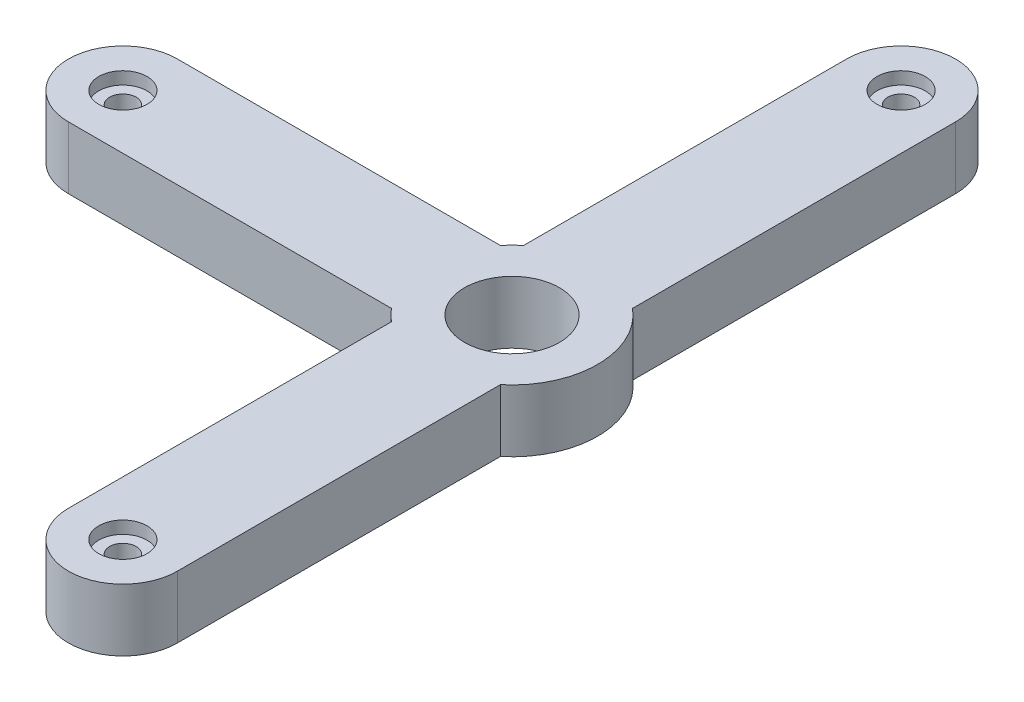
from build123d import *

# Parameters (mm, degrees)
BASE_OUTLINE_SKETCH_R          = 1.7
BASE_OUTLINE_SKETCH_R_2        = 1.75
BASE_OUTLINE_SKETCH_R_3        = 6.1
BASE_OUTLINE_DEPTH             = 4
INTERFACE_PROFILE_2_SKETCH_R   = 1.7
INTERFACE_PROFILE_2_SKETCH_R_2 = 6.1
INTERFACE_PROFILE_2_SKETCH_R_3 = 1.1
INTERFACE_PROFILE_2_DEPTH      = 2.4
INTERFACE_PROFILE_3_SKETCH_R   = 6.1
INTERFACE_PROFILE_3_SKETCH_R_2 = 3.1
INTERFACE_PROFILE_3_SKETCH_R_3 = 1.1
INTERFACE_PROFILE_3_DEPTH      = 0.6
INTERFACE_PROFILE_4_SKETCH_R   = 6.1
INTERFACE_PROFILE_4_SKETCH_R_2 = 3.1
INTERFACE_PROFILE_4_DEPTH      = 1


with BuildPart() as part:
    # Base Outline Sketch → Base Outline (new body)
    with BuildSketch(Plane(origin=(0, -157, 0), x_dir=(1, 0, 0), z_dir=(0, 1, 0))):
        with BuildLine():
            Line((-106.291651246, -7), (-64.77693262, -7))
            ThreePointArc((-64.77693262, -7), (-64.069825839, -7.778174593), (-63.291651246, -8.485281374))
            Line((-63.291651246, -8.485281374), (-63.291651246, -50))
            ThreePointArc((-63.291651246, -50), (-56.291651246, -57), (-49.291651246, -50))
            Line((-49.291651246, -50), (-49.291651246, -8.485281374))
            ThreePointArc((-49.291651246, -8.485281374), (-45.291651246, 0), (-49.291651246, 8.485281374))
            Line((-49.291651246, 8.485281374), (-49.291651246, 50))
            ThreePointArc((-49.291651246, 50), (-56.291651246, 57), (-63.291651246, 50))
            Line((-63.291651246, 50), (-63.291651246, 8.485281374))
            ThreePointArc((-63.291651246, 8.485281374), (-64.069825839, 7.778174593), (-64.77693262, 7))
            Line((-64.77693262, 7), (-106.291651246, 7))
            ThreePointArc((-106.291651246, 7), (-113.291651246, 0), (-106.291651246, -7))
        make_face()
        with Locations(Location((-106.291651246, 0, 0), (0, 0, 270))):
            Circle(BASE_OUTLINE_SKETCH_R, mode=Mode.SUBTRACT)
        with Locations(Location((-56.291651246, 50, 0), (0, 0, 270))):
            Circle(BASE_OUTLINE_SKETCH_R, mode=Mode.SUBTRACT)
        with Locations(Location((-56.291651246, 9, 0), (0, 0, 270))):
            Circle(BASE_OUTLINE_SKETCH_R_2, mode=Mode.SUBTRACT)
        with Locations(Location((-65.291651246, 0, 0), (0, 0, 270))):
            Circle(BASE_OUTLINE_SKETCH_R_2, mode=Mode.SUBTRACT)
        with Locations(Location((-56.291651246, 0, 0), (0, 0, 270))):
            Circle(BASE_OUTLINE_SKETCH_R_3, mode=Mode.SUBTRACT)
        with Locations(Location((-56.291651246, -9, 0), (0, 0, 270))):
            Circle(BASE_OUTLINE_SKETCH_R_2, mode=Mode.SUBTRACT)
        with Locations(Location((-56.291651246, -50, 0), (0, 0, 270))):
            Circle(BASE_OUTLINE_SKETCH_R, mode=Mode.SUBTRACT)
    extrude(amount=BASE_OUTLINE_DEPTH)

    # Interface Profile 2 Sketch → Interface Profile 2 (add)
    with BuildSketch(Plane(origin=(0, -153, 0), x_dir=(1, 0, 0), z_dir=(0, 1, 0))):
        with BuildLine():
            Line((-106.291651246, -7), (-64.77693262, -7))
            ThreePointArc((-64.77693262, -7), (-64.069825839, -7.778174593), (-63.291651246, -8.485281374))
            Line((-63.291651246, -8.485281374), (-63.291651246, -50))
            ThreePointArc((-63.291651246, -50), (-56.291651246, -57), (-49.291651246, -50))
            Line((-49.291651246, -50), (-49.291651246, -8.485281374))
            ThreePointArc((-49.291651246, -8.485281374), (-45.291651246, 0), (-49.291651246, 8.485281374))
            Line((-49.291651246, 8.485281374), (-49.291651246, 50))
            ThreePointArc((-49.291651246, 50), (-56.291651246, 57), (-63.291651246, 50))
            Line((-63.291651246, 50), (-63.291651246, 8.485281374))
            ThreePointArc((-63.291651246, 8.485281374), (-64.069825839, 7.778174593), (-64.77693262, 7))
            Line((-64.77693262, 7), (-106.291651246, 7))
            ThreePointArc((-106.291651246, 7), (-113.291651246, 0), (-106.291651246, -7))
        make_face()
        with Locations(Location((-106.291651246, 0, 0), (0, 0, 270))):
            Circle(INTERFACE_PROFILE_2_SKETCH_R, mode=Mode.SUBTRACT)
        with Locations(Location((-56.291651246, 50, 0), (0, 0, 270))):
            Circle(INTERFACE_PROFILE_2_SKETCH_R, mode=Mode.SUBTRACT)
        with Locations(Location((-56.291651246, 0, 0), (0, 0, 270))):
            Circle(INTERFACE_PROFILE_2_SKETCH_R_2, mode=Mode.SUBTRACT)
        with Locations(Location((-56.291651246, -50, 0), (0, 0, 270))):
            Circle(INTERFACE_PROFILE_2_SKETCH_R, mode=Mode.SUBTRACT)
        with Locations(Location((-56.291651246, 9, 0), (0, 0, 270))):
            Circle(INTERFACE_PROFILE_2_SKETCH_R_3, mode=Mode.SUBTRACT)
        with Locations(Location((-65.291651246, 0, 0), (0, 0, 270))):
            Circle(INTERFACE_PROFILE_2_SKETCH_R_3, mode=Mode.SUBTRACT)
        with Locations(Location((-56.291651246, -9, 0), (0, 0, 270))):
            Circle(INTERFACE_PROFILE_2_SKETCH_R_3, mode=Mode.SUBTRACT)
    extrude(amount=INTERFACE_PROFILE_2_DEPTH)

    # Interface Profile 3 Sketch → Interface Profile 3 (add)
    with BuildSketch(Plane(origin=(0, -150.6, 0), x_dir=(1, 0, 0), z_dir=(0, 1, 0))):
        with BuildLine():
            Line((-106.291651246, -7), (-64.77693262, -7))
            ThreePointArc((-64.77693262, -7), (-64.069825839, -7.778174593), (-63.291651246, -8.485281374))
            Line((-63.291651246, -8.485281374), (-63.291651246, -50))
            ThreePointArc((-63.291651246, -50), (-56.291651246, -57), (-49.291651246, -50))
            Line((-49.291651246, -50), (-49.291651246, -8.485281374))
            ThreePointArc((-49.291651246, -8.485281374), (-45.291651246, 0), (-49.291651246, 8.485281374))
            Line((-49.291651246, 8.485281374), (-49.291651246, 50))
            ThreePointArc((-49.291651246, 50), (-56.291651246, 57), (-63.291651246, 50))
            Line((-63.291651246, 50), (-63.291651246, 8.485281374))
            ThreePointArc((-63.291651246, 8.485281374), (-64.069825839, 7.778174593), (-64.77693262, 7))
            Line((-64.77693262, 7), (-106.291651246, 7))
            ThreePointArc((-106.291651246, 7), (-113.291651246, 0), (-106.291651246, -7))
        make_face()
        with Locations(Location((-56.291651246, 0, 0), (0, 0, 270))):
            Circle(INTERFACE_PROFILE_3_SKETCH_R, mode=Mode.SUBTRACT)
        with Locations(Location((-106.291651246, 0, 0), (0, 0, 270))):
            Circle(INTERFACE_PROFILE_3_SKETCH_R_2, mode=Mode.SUBTRACT)
        with Locations(Location((-56.291651246, 50, 0), (0, 0, 270))):
            Circle(INTERFACE_PROFILE_3_SKETCH_R_2, mode=Mode.SUBTRACT)
        with Locations(Location((-56.291651246, -50, 0), (0, 0, 270))):
            Circle(INTERFACE_PROFILE_3_SKETCH_R_2, mode=Mode.SUBTRACT)
        with Locations(Location((-56.291651246, 9, 0), (0, 0, 270))):
            Circle(INTERFACE_PROFILE_3_SKETCH_R_3, mode=Mode.SUBTRACT)
        with Locations(Location((-65.291651246, 0, 0), (0, 0, 270))):
            Circle(INTERFACE_PROFILE_3_SKETCH_R_3, mode=Mode.SUBTRACT)
        with Locations(Location((-56.291651246, -9, 0), (0, 0, 270))):
            Circle(INTERFACE_PROFILE_3_SKETCH_R_3, mode=Mode.SUBTRACT)
    extrude(amount=INTERFACE_PROFILE_3_DEPTH)

    # Interface Profile 4 Sketch → Interface Profile 4 (add)
    with BuildSketch(Plane(origin=(0, -150, 0), x_dir=(1, 0, 0), z_dir=(0, 1, 0))):
        with BuildLine():
            Line((-106.291651246, -7), (-64.77693262, -7))
            ThreePointArc((-64.77693262, -7), (-64.069825839, -7.778174593), (-63.291651246, -8.485281374))
            Line((-63.291651246, -8.485281374), (-63.291651246, -50))
            ThreePointArc((-63.291651246, -50), (-56.291651246, -57), (-49.291651246, -50))
            Line((-49.291651246, -50), (-49.291651246, -8.485281374))
            ThreePointArc((-49.291651246, -8.485281374), (-45.291651246, 0), (-49.291651246, 8.485281374))
            Line((-49.291651246, 8.485281374), (-49.291651246, 50))
            ThreePointArc((-49.291651246, 50), (-56.291651246, 57), (-63.291651246, 50))
            Line((-63.291651246, 50), (-63.291651246, 8.485281374))
            ThreePointArc((-63.291651246, 8.485281374), (-64.069825839, 7.778174593), (-64.77693262, 7))
            Line((-64.77693262, 7), (-106.291651246, 7))
            ThreePointArc((-106.291651246, 7), (-113.291651246, 0), (-106.291651246, -7))
        make_face()
        with Locations(Location((-56.291651246, 0, 0), (0, 0, 270))):
            Circle(INTERFACE_PROFILE_4_SKETCH_R, mode=Mode.SUBTRACT)
        with Locations(Location((-106.291651246, 0, 0), (0, 0, 270))):
            Circle(INTERFACE_PROFILE_4_SKETCH_R_2, mode=Mode.SUBTRACT)
        with Locations(Location((-56.291651246, 50, 0), (0, 0, 270))):
            Circle(INTERFACE_PROFILE_4_SKETCH_R_2, mode=Mode.SUBTRACT)
        with Locations(Location((-56.291651246, -50, 0), (0, 0, 270))):
            Circle(INTERFACE_PROFILE_4_SKETCH_R_2, mode=Mode.SUBTRACT)
    extrude(amount=INTERFACE_PROFILE_4_DEPTH)


solid = part.part
